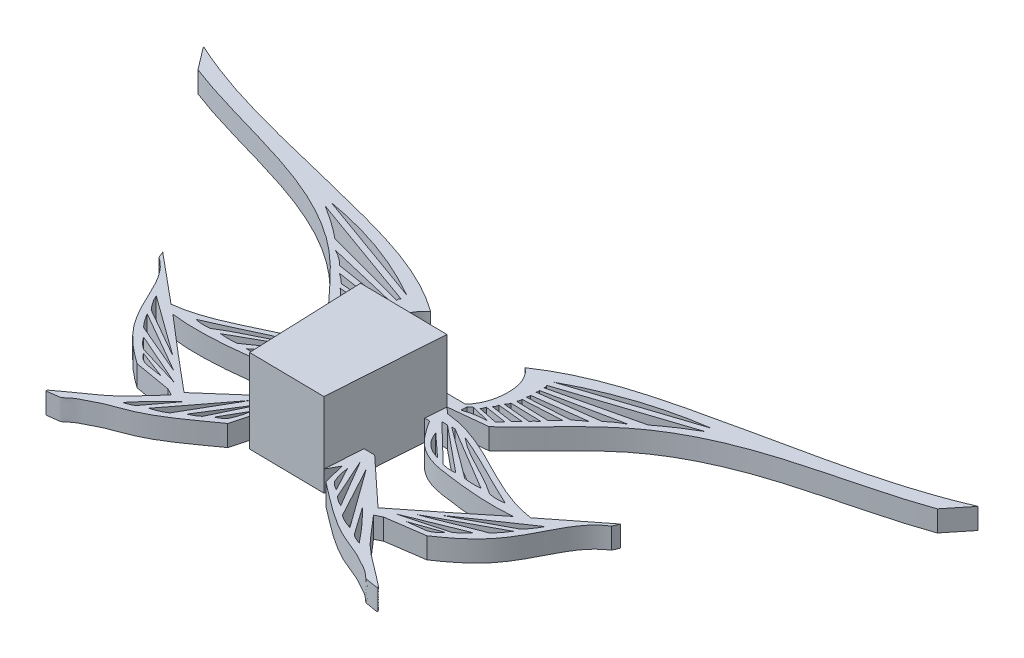
from build123d import *

# Parameters (mm, degrees)
EXTRUDE_2_DEPTH = 5
EXTRUDE_4_DEPTH = 20


with BuildPart() as part:
    # 草图1 → 凸台-拉伸2 (new body)
    with BuildSketch(Plane(origin=(0, 0, 0), x_dir=(1, 0, 0), z_dir=(0, 1, 0))):
        with BuildLine():
            Line((-16.103773819, -29.898359089), (-14.490886088, -30.755289496))
            add(Edge.make_bspline(
                [(-14.490886088, -30.755289496), (-20.884669309, -37.499295163), (-18.447995148, -36.236440216), (-31.189451968, -45.028910304), (-26.993954421, -44.438191538), (-27.357635824, -44.648190251), (-25.248865907, -42.845555476), (-23.405980948, -42.044069648), (-20.595558929, -40.429081018), (-12.612070301, -38.071297427), (-6.528604055, -33.194707099), (-1.848850836, -29.898359089)],
                knots=[0, 0, 0, 0, 0.138213288, 0.158313918, 0.168524285, 0.240316957, 0.287507408, 0.343449858, 0.409538759, 0.538479735, 1, 1, 1, 1], degree=3))
            Line((-1.848850836, -29.898359089), (-0.445645395, -24.742363794))
            Line((-0.445645395, -24.742363794), (1.065498926, -27.584754302))
            Line((1.065498926, -27.584754302), (19.077453467, -27.839259259))
            Line((19.077453467, -27.839259259), (20.668303178, -25.040699244))
            Line((20.668303178, -25.040699244), (21.925271354, -30.234282207))
            add(Edge.make_bspline(
                [(34.538047989, -31.448057553), (40.738734082, -38.370020301), (38.338713296, -37.038823918), (50.82666171, -46.187779954), (46.649529217, -45.478757766), (47.007132144, -45.698948069), (44.950135591, -43.83745193), (43.130631467, -42.984217349), (40.366961188, -41.290468021), (32.453276369, -38.708060865), (26.510021564, -33.661535614), (21.925271354, -30.234282207)],
                knots=[0, 0, 0, 0, 0.138213288, 0.158313918, 0.168524285, 0.240316957, 0.287507408, 0.343449858, 0.409538759, 0.538479735, 1, 1, 1, 1], degree=3))
            Line((34.538047989, -31.448057553), (36.174503464, -30.63703965))
            Line((36.174503464, -30.63703965), (45.171670829, -29.346902954))
            add(Edge.make_bspline(
                [(65.249495162, -5.273250668), (61.766263907, -7.501627612), (58.752904031, -13.633337302), (53.744023944, -23.084612304), (48.232629608, -27.292598923), (45.171670829, -29.346902954)],
                knots=[0, 0, 0, 0, 0.362458305, 0.64917474, 1, 1, 1, 1], degree=3))
            Line((65.249495162, -5.273250668), (65.893558852, -3.785938561))
            Line((65.893558852, -3.785938561), (53.873583233, -13.221108944))
            add(Edge.make_bspline(
                [(22.461513178, -1.624515792), (33.855828878, -2.720380763), (42.541642387, -11.597724795), (53.873583233, -13.221108944)],
                knots=[0, 0, 0, 0, 1, 1, 1, 1], degree=3))
            Line((22.461513178, -1.624515792), (20.921904443, -0.295621909))
            Line((20.921904443, -0.295621909), (30.060393929, 0.666159162))
            add(Edge.make_bspline(
                [(100.611993759, 37.211299403), (88.298262435, 32.83638113), (69.501657366, 30.01745681), (45.090813635, 17.335397796), (36.097400095, 6.236393186), (30.060393929, 0.666159162)],
                knots=[0, 0, 0, 0, 0.482735813, 0.695059024, 1, 1, 1, 1], degree=3))
            Line((100.611993759, 37.211299403), (104.954981583, 42.59415762))
            add(Edge.make_bspline(
                [(22.144921218, 17.160212546), (31.525905639, 23.57487669), (47.510430234, 27.686769801), (75.810112282, 33.739350726), (93.315699901, 37.547379753), (104.954981583, 42.59415762)],
                knots=[0, 0, 0, 0, 0.384359586, 0.564437476, 1, 1, 1, 1], degree=3))
            add(Edge.make_bspline(
                [(22.144921218, 17.160212546), (24.509893208, 15.323249999), (25.990560817, 9.903430905), (24.36483621, 4.419213059), (22.577706713, 2.486317386)],
                knots=[0, 0, 0, 0, 0.513587115, 1, 1, 1, 1], degree=3))
            Line((22.577706713, 2.486317386), (-1.57654055, 2.827611588))
            add(Edge.make_bspline(
                [(-0.729332783, 17.483420725), (-3.145262015, 15.71401126), (-4.778469642, 10.338190539), (-3.308344707, 4.81022902), (-1.57654055, 2.827611588)],
                knots=[0, 0, 0, 0, 0.513587115, 1, 1, 1, 1], degree=3))
            add(Edge.make_bspline(
                [(-0.729332783, 17.483420725), (-9.925332708, 24.160573572), (-25.787298838, 28.722450593), (-53.904673908, 35.572192129), (-71.295681173, 39.873302368), (-82.787724947, 45.246920776)],
                knots=[0, 0, 0, 0, 0.384359586, 0.564437476, 1, 1, 1, 1], degree=3))
            Line((-82.787724947, 45.246920776), (-78.598557779, 39.743505086))
            add(Edge.make_bspline(
                [(-78.598557779, 39.743505086), (-66.413350951, 35.022422204), (-47.703895554, 31.673545498), (-23.661115032, 18.306847429), (-14.984882238, 6.958174602), (-9.107667118, 1.219595251)],
                knots=[0, 0, 0, 0, 0.482735813, 0.695059024, 1, 1, 1, 1], degree=3))
            Line((-9.107667118, 1.219595251), (0, 0))
            Line((0, 0), (-1.57654055, -1.284863379))
            add(Edge.make_bspline(
                [(-1.57654055, -1.284863379), (-12.997269873, -2.058356781), (-21.930435578, -10.686748512), (-33.303719432, -11.989312829)],
                knots=[0, 0, 0, 0, 1, 1, 1, 1], degree=3))
            Line((-33.303719432, -11.989312829), (-45.052315875, -2.218297749))
            Line((-45.052315875, -2.218297749), (-44.450531705, -3.723213413))
            add(Edge.make_bspline(
                [(-44.450531705, -3.723213413), (-41.031651414, -6.049115675), (-38.192739367, -12.263516681), (-33.452894494, -21.852539022), (-28.062592541, -26.214564213), (-25.060897902, -28.354532203)],
                knots=[0, 0, 0, 0, 0.362458305, 0.64917474, 1, 1, 1, 1], degree=3))
            Line((-25.060897902, -28.354532203), (-16.103773819, -29.898359089))
        make_face()
        with BuildLine():
            Line((-35.182838385, 28.178383105), (-7.096711501, 18.095243558))
            add(Edge.make_bspline(
                [(-35.182838385, 28.178383105), (-20.248090795, 25.642813669), (-7.096711501, 18.095243558)],
                knots=[0, 0, 0, 1, 1, 1], degree=2))
        make_face(mode=Mode.SUBTRACT)
        with BuildLine():
            Line((-27.226324633, 21.101852441), (-7.096711501, 15.748621991))
            add(Edge.make_bspline(
                [(-6.962377893, 16.59490624), (-7.386571889, 16.214051513), (-7.096711501, 15.748621991)],
                knots=[0, 0, 0, 1, 1, 1], degree=2))
            Line((-6.962377893, 16.59490624), (-35.182838385, 26.748410587))
            add(Edge.make_bspline(
                [(-35.182838385, 26.748410587), (-31.011643798, 24.200471227), (-27.226324633, 21.101852441)],
                knots=[0, 0, 0, 1, 1, 1], degree=2))
        make_face(mode=Mode.SUBTRACT)
        with BuildLine():
            Line((-21.139774943, 16.152868078), (-7.096711501, 13.89645491))
            add(Edge.make_bspline(
                [(-7.212800722, 14.662905206), (-7.429805602, 14.248762569), (-7.096711501, 13.89645491)],
                knots=[0, 0, 0, 1, 1, 1], degree=2))
            Line((-7.212800722, 14.662905206), (-24.774009417, 18.797669248))
            add(Edge.make_bspline(
                [(-24.774009417, 18.797669248), (-22.73761671, 17.753086901), (-21.139774943, 16.152868078)],
                knots=[0, 0, 0, 1, 1, 1], degree=2))
        make_face(mode=Mode.SUBTRACT)
        with BuildLine():
            Line((-17.203335074, 12.610095473), (-7.096711501, 11.704444121))
            add(Edge.make_bspline(
                [(-7.212800722, 12.610095473), (-7.346401022, 12.118621353), (-7.096711501, 11.704444121)],
                knots=[0, 0, 0, 1, 1, 1], degree=2))
            Line((-7.212800722, 12.610095473), (-19.618405347, 14.542151692))
            add(Edge.make_bspline(
                [(-19.618405347, 14.542151692), (-18.328722121, 13.678456736), (-17.203335074, 12.610095473)],
                knots=[0, 0, 0, 1, 1, 1], degree=2))
        make_face(mode=Mode.SUBTRACT)
        with BuildLine():
            Line((-14.568441476, 9.684985554), (-6.878909657, 9.684985554))
            add(Edge.make_bspline(
                [(-7.096711501, 10.758541597), (-7.210272787, 10.172545053), (-6.878909657, 9.684985554)],
                knots=[0, 0, 0, 1, 1, 1], degree=2))
            Line((-7.096711501, 10.758541597), (-16.415490281, 11.532034359))
            add(Edge.make_bspline(
                [(-16.415490281, 11.532034359), (-15.39023398, 10.70783761), (-14.568441476, 9.684985554)],
                knots=[0, 0, 0, 1, 1, 1], degree=2))
        make_face(mode=Mode.SUBTRACT)
        with BuildLine():
            Line((-12.597455703, 7.173307626), (-6.033635061, 7.598824657))
            add(Edge.make_bspline(
                [(-6.577025872, 8.645355108), (-6.588564664, 7.987642833), (-6.033635061, 7.598824657)],
                knots=[0, 0, 0, 1, 1, 1], degree=2))
            Line((-6.577025872, 8.645355108), (-14.069503186, 8.645355108))
            add(Edge.make_bspline(
                [(-14.069503186, 8.645355108), (-13.220747499, 8.018539858), (-12.597455703, 7.173307626)],
                knots=[0, 0, 0, 1, 1, 1], degree=2))
        make_face(mode=Mode.SUBTRACT)
        with BuildLine():
            Line((-10.561891823, 5.002624113), (-5.127983709, 5.656705645))
            add(Edge.make_bspline(
                [(-5.651248934, 6.753550061), (-5.724038036, 6.080064551), (-5.127983709, 5.656705645)],
                knots=[0, 0, 0, 1, 1, 1], degree=2))
            Line((-5.651248934, 6.753550061), (-11.870054888, 6.310787178))
            add(Edge.make_bspline(
                [(-11.870054888, 6.310787178), (-11.164820436, 5.706807997), (-10.561891823, 5.002624113)],
                knots=[0, 0, 0, 1, 1, 1], degree=2))
        make_face(mode=Mode.SUBTRACT)
        with BuildLine():
            Line((-36.84765898, -11.989312829), (-22.414436084, -22.449877147))
            Line((-22.414436084, -22.449877147), (-34.46516185, -15.573723069))
            add(Edge.make_bspline(
                [(-36.84765898, -11.989312829), (-35.929119346, -13.978075815), (-34.46516185, -15.573723069)],
                knots=[0, 0, 0, 1, 1, 1], degree=2))
        make_face(mode=Mode.SUBTRACT)
        with BuildLine():
            Line((-8.763785997, 2.936617502), (-4.222332356, 3.73471222))
            add(Edge.make_bspline(
                [(-4.624844068, 4.801368257), (-4.476594662, 4.247232566), (-4.222332356, 3.73471222)],
                knots=[0, 0, 0, 1, 1, 1], degree=2))
            Line((-4.624844068, 4.801368257), (-9.944266841, 4.117098346))
            add(Edge.make_bspline(
                [(-9.944266841, 4.117098346), (-9.328370075, 3.552076692), (-8.763785997, 2.936617502)],
                knots=[0, 0, 0, 1, 1, 1], degree=2))
        make_face(mode=Mode.SUBTRACT)
        with BuildLine():
            Line((-7.72998178, 2.222902012), (-3.135550733, 3.171195822))
            Line((-3.135550733, 3.171195822), (-2.31624848, 2.539010698))
            Line((-2.31624848, 2.539010698), (-2.31624848, 1.09027332))
            add(Edge.make_bspline(
                [(-7.72998178, 2.222902012), (-4.908530756, 2.12376403), (-2.31624848, 1.09027332)],
                knots=[0, 0, 0, 1, 1, 1], degree=2))
        make_face(mode=Mode.SUBTRACT)
        with BuildLine():
            Line((-21.277849249, -12.169413542), (-5.619725363, -3.409622108))
            Line((-5.619725363, -3.409622108), (-4.777911564, -3.409622108))
            Line((-4.777911564, -3.409622108), (-17.294022325, -12.185739206))
            add(Edge.make_bspline(
                [(-21.277849249, -12.169413542), (-19.284856232, -12.422115128), (-17.294022325, -12.185739206)],
                knots=[0, 0, 0, 1, 1, 1], degree=2))
        make_face(mode=Mode.SUBTRACT)
        with BuildLine():
            Line((-15.060534866, -12.169413542), (-3.907902416, -3.560230994))
            Line((-3.907902416, -3.560230994), (-2.533839168, -3.560230994))
            Line((-2.533839168, -3.560230994), (-11.775299344, -11.989312829))
            add(Edge.make_bspline(
                [(-15.060534866, -12.169413542), (-13.387909137, -12.414610369), (-11.775299344, -11.989312829)],
                knots=[0, 0, 0, 1, 1, 1], degree=2))
        make_face(mode=Mode.SUBTRACT)
        with BuildLine():
            Line((-9.696270638, -11.331649493), (-4.222332356, -6.583488886))
            add(Edge.make_bspline(
                [(-4.222332356, -6.583488886), (-5.675921625, -10.412613855), (-9.696270638, -11.331649493)],
                knots=[0, 0, 0, 1, 1, 1], degree=2))
        make_face(mode=Mode.SUBTRACT)
        with BuildLine():
            Line((-34.190967534, -16.812533396), (-19.152491915, -25.453678758))
            Line((-19.152491915, -25.453678758), (-31.801181639, -20.077041431))
            add(Edge.make_bspline(
                [(-34.190967534, -16.812533396), (-33.148322725, -18.557993128), (-31.801181639, -20.077041431)],
                knots=[0, 0, 0, 1, 1, 1], degree=2))
        make_face(mode=Mode.SUBTRACT)
        with BuildLine():
            Line((-29.805020775, -22.059096425), (-16.825789187, -27.761152537))
            Line((-16.825789187, -27.761152537), (-27.226324633, -24.629598887))
            add(Edge.make_bspline(
                [(-29.805020775, -22.059096425), (-28.753568462, -23.570254947), (-27.226324633, -24.629598887)],
                knots=[0, 0, 0, 1, 1, 1], degree=2))
        make_face(mode=Mode.SUBTRACT)
        with BuildLine():
            Line((-26.403696421, -25.453678758), (-19.618405347, -28.040940898))
            Line((-19.618405347, -28.040940898), (-23.753393557, -27.400982827))
            add(Edge.make_bspline(
                [(-26.403696421, -25.453678758), (-25.454954951, -26.959998203), (-23.753393557, -27.400982827)],
                knots=[0, 0, 0, 1, 1, 1], degree=2))
        make_face(mode=Mode.SUBTRACT)
        with BuildLine():
            Line((-3.907902416, -22.449877147), (-14.415839762, -36.170569033))
            add(Edge.make_bspline(
                [(-14.415839762, -36.170569033), (-12.54622165, -35.702818924), (-10.955616626, -34.661907538)],
                knots=[0, 0, 0, 1, 1, 1], degree=2))
            Line((-10.955616626, -34.661907538), (-3.907902416, -22.449877147))
        make_face(mode=Mode.SUBTRACT)
        with BuildLine():
            Line((-16.488222725, -37.137514335), (-11.459063089, -30.418720963))
            add(Edge.make_bspline(
                [(-11.459063089, -30.418720963), (-15.368555435, -34.053202491), (-18.795038149, -38.140885271)],
                knots=[0, 0, 0, 1, 1, 1], degree=2))
            add(Edge.make_bspline(
                [(-18.795038149, -38.140885271), (-17.56459076, -37.811943726), (-16.488222725, -37.137514335)],
                knots=[0, 0, 0, 1, 1, 1], degree=2))
        make_face(mode=Mode.SUBTRACT)
        with BuildLine():
            Line((-8.667555799, -32.861466231), (-1.57654055, -21.581573034))
            Line((-1.57654055, -21.581573034), (-6.351363076, -31.473626057))
            add(Edge.make_bspline(
                [(-8.667555799, -32.861466231), (-7.397877731, -32.343744937), (-6.351363076, -31.473626057)],
                knots=[0, 0, 0, 1, 1, 1], degree=2))
        make_face(mode=Mode.SUBTRACT)
        with BuildLine():
            Line((-4.777911564, -30.21116539), (-1.57654055, -24.629598887))
            add(Edge.make_bspline(
                [(-1.57654055, -24.629598887), (-1.819327272, -26.800151593), (-2.780160589, -28.727289228)],
                knots=[0, 0, 0, 1, 1, 1], degree=2))
            add(Edge.make_bspline(
                [(-4.777911564, -30.21116539), (-3.582687149, -29.722654584), (-2.780160589, -28.727289228)],
                knots=[0, 0, 0, 1, 1, 1], degree=2))
        make_face(mode=Mode.SUBTRACT)
        with BuildLine():
            Line((30.893812613, -35.25323077), (24.193949723, -22.846950138))
            Line((24.193949723, -22.846950138), (34.310028753, -36.85905484))
            add(Edge.make_bspline(
                [(34.310028753, -36.85905484), (32.454372807, -36.338667427), (30.893812613, -35.25323077)],
                knots=[0, 0, 0, 1, 1, 1], degree=2))
        make_face(mode=Mode.SUBTRACT)
        with BuildLine():
            Line((26.381478628, -31.936133912), (21.888051582, -21.913122561))
            Line((21.888051582, -21.913122561), (28.657534752, -33.388861553))
            add(Edge.make_bspline(
                [(28.657534752, -33.388861553), (27.402991223, -32.835473562), (26.381478628, -31.936133912)],
                knots=[0, 0, 0, 1, 1, 1], degree=2))
        make_face(mode=Mode.SUBTRACT)
        with BuildLine():
            Line((24.844324734, -30.629721074), (21.801932905, -24.959931575))
            add(Edge.make_bspline(
                [(21.801932905, -24.959931575), (21.983296081, -27.136477427), (22.889296622, -29.089993014)],
                knots=[0, 0, 0, 1, 1, 1], degree=2))
            add(Edge.make_bspline(
                [(24.844324734, -30.629721074), (23.663379823, -30.107635518), (22.889296622, -29.089993014)],
                knots=[0, 0, 0, 1, 1, 1], degree=2))
        make_face(mode=Mode.SUBTRACT)
        with BuildLine():
            Line((36.354264381, -37.884167057), (31.51694474, -31.025962503))
            add(Edge.make_bspline(
                [(31.51694474, -31.025962503), (35.322187984, -34.769451548), (38.631809713, -38.952314003)],
                knots=[0, 0, 0, 1, 1, 1], degree=2))
            add(Edge.make_bspline(
                [(38.631809713, -38.952314003), (37.411147433, -38.588738817), (36.354264381, -37.884167057)],
                knots=[0, 0, 0, 1, 1, 1], degree=2))
        make_face(mode=Mode.SUBTRACT)
        with BuildLine():
            Line((39.740211218, -28.879665096), (43.891629975, -28.356792134))
            add(Edge.make_bspline(
                [(46.595893752, -26.485146914), (45.604971612, -27.964059339), (43.891629975, -28.356792134)],
                knots=[0, 0, 0, 1, 1, 1], degree=2))
            Line((46.595893752, -26.485146914), (39.740211218, -28.879665096))
        make_face(mode=Mode.SUBTRACT)
        with BuildLine():
            Line((36.956615049, -28.521086082), (47.44147704, -25.684638504))
            add(Edge.make_bspline(
                [(50.091770479, -23.188020515), (48.998041778, -24.668868101), (47.44147704, -25.684638504)],
                knots=[0, 0, 0, 1, 1, 1], degree=2))
            Line((50.091770479, -23.188020515), (36.956615049, -28.521086082))
        make_face(mode=Mode.SUBTRACT)
        with BuildLine():
            Line((39.347584084, -26.280271967), (52.143135254, -21.263156169))
            add(Edge.make_bspline(
                [(54.624202241, -18.067472213), (53.5326576, -19.782776318), (52.143135254, -21.263156169)],
                knots=[0, 0, 0, 1, 1, 1], degree=2))
            Line((54.624202241, -18.067472213), (39.347584084, -26.280271967))
        make_face(mode=Mode.SUBTRACT)
        with BuildLine():
            Line((30.29414061, -11.896705209), (24.956541789, -6.995779961))
            add(Edge.make_bspline(
                [(24.956541789, -6.995779961), (26.301362966, -10.864445854), (30.29414061, -11.896705209)],
                knots=[0, 0, 0, 1, 1, 1], degree=2))
        make_face(mode=Mode.SUBTRACT)
        with BuildLine():
            Line((23.354141569, -3.926022469), (32.353757756, -12.612846701))
            add(Edge.make_bspline(
                [(35.63259319, -12.885696293), (33.953707438, -13.083537), (32.353757756, -12.612846701)],
                knots=[0, 0, 0, 1, 1, 1], degree=2))
            Line((35.63259319, -12.885696293), (24.727656261, -3.964845141))
            Line((24.727656261, -3.964845141), (23.354141569, -3.926022469))
        make_face(mode=Mode.SUBTRACT)
        with BuildLine():
            Line((25.601573374, -3.83887755), (37.864727729, -12.965120214))
            add(Edge.make_bspline(
                [(41.847425486, -13.061359792), (39.848088305, -13.257650631), (37.864727729, -12.965120214)],
                knots=[0, 0, 0, 1, 1, 1], degree=2))
            Line((41.847425486, -13.061359792), (26.443051103, -3.862662089))
            Line((26.443051103, -3.862662089), (25.601573374, -3.83887755))
        make_face(mode=Mode.SUBTRACT)
        with BuildLine():
            Line((42.693095183, -23.369832246), (54.93328834, -16.836903511))
            add(Edge.make_bspline(
                [(57.416107963, -13.321239126), (56.441744682, -15.28325581), (54.93328834, -16.836903511)],
                knots=[0, 0, 0, 1, 1, 1], degree=2))
            Line((57.416107963, -13.321239126), (42.693095183, -23.369832246))
        make_face(mode=Mode.SUBTRACT)
        with BuildLine():
            Line((23.30896523, 2.176932064), (23.268032721, 0.728773053))
            add(Edge.make_bspline(
                [(28.711605941, 1.707990391), (25.888480265, 1.688609037), (23.268032721, 0.728773053)],
                knots=[0, 0, 0, 1, 1, 1], degree=2))
            Line((28.711605941, 1.707990391), (24.145802108, 2.785716306))
            Line((24.145802108, 2.785716306), (23.30896523, 2.176932064))
        make_face(mode=Mode.SUBTRACT)
        with BuildLine():
            Line((30.978525482, 3.53886829), (25.680559645, 4.373159567))
            add(Edge.make_bspline(
                [(25.680559645, 4.373159567), (25.556150915, 3.804573877), (25.24807141, 3.318301895)],
                knots=[0, 0, 0, 1, 1, 1], degree=2))
            Line((25.24807141, 3.318301895), (29.765162701, 2.39221193))
            add(Edge.make_bspline(
                [(30.978525482, 3.53886829), (30.346910519, 2.991473702), (29.765162701, 2.39221193)],
                knots=[0, 0, 0, 1, 1, 1], degree=2))
        make_face(mode=Mode.SUBTRACT)
        with BuildLine():
            Line((32.965525019, 5.677270293), (26.761711535, 6.295562058))
            add(Edge.make_bspline(
                [(26.761711535, 6.295562058), (26.815442972, 5.62028884), (26.207665054, 5.213939819)],
                knots=[0, 0, 0, 1, 1, 1], degree=2))
            Line((26.207665054, 5.213939819), (31.620923468, 4.406590209))
            add(Edge.make_bspline(
                [(32.965525019, 5.677270293), (32.243507334, 5.093457872), (31.620923468, 4.406590209)],
                knots=[0, 0, 0, 1, 1, 1], degree=2))
        make_face(mode=Mode.SUBTRACT)
        with BuildLine():
            Line((37.656666473, 10.768006675), (28.319753749, 10.258114732))
            add(Edge.make_bspline(
                [(28.319753749, 10.258114732), (28.416713, 9.669143579), (28.07170669, 9.191141031)],
                knots=[0, 0, 0, 1, 1, 1], degree=2))
            Line((28.07170669, 9.191141031), (35.758168681, 8.97388162))
            add(Edge.make_bspline(
                [(37.656666473, 10.768006675), (36.608532688, 9.973106472), (35.758168681, 8.97388162)],
                knots=[0, 0, 0, 1, 1, 1], degree=2))
        make_face(mode=Mode.SUBTRACT)
        with BuildLine():
            Line((35.230055944, 7.948763179), (27.74056979, 8.160455028))
            add(Edge.make_bspline(
                [(27.74056979, 8.160455028), (27.733521025, 7.50267931), (27.167827325, 7.129695294)],
                knots=[0, 0, 0, 1, 1, 1], degree=2))
            Line((27.167827325, 7.129695294), (33.717005024, 6.518894481))
            add(Edge.make_bspline(
                [(35.230055944, 7.948763179), (34.363929112, 7.346178842), (33.717005024, 6.518894481)],
                knots=[0, 0, 0, 1, 1, 1], degree=2))
        make_face(mode=Mode.SUBTRACT)
        with BuildLine():
            Line((40.943350478, 13.6864274), (28.488110279, 12.105649452))
            add(Edge.make_bspline(
                [(28.488110279, 12.105649452), (28.607771173, 11.610596806), (28.346479203, 11.203639631)],
                knots=[0, 0, 0, 1, 1, 1], degree=2))
            Line((28.346479203, 11.203639631), (38.474656193, 11.823377701))
            add(Edge.make_bspline(
                [(40.943350478, 13.6864274), (39.629779353, 12.859515856), (38.474656193, 11.823377701)],
                knots=[0, 0, 0, 1, 1, 1], degree=2))
        make_face(mode=Mode.SUBTRACT)
        with BuildLine():
            Line((46.217131368, 17.794580041), (28.546110199, 14.157639658))
            add(Edge.make_bspline(
                [(28.546110199, 14.157639658), (28.751327293, 13.737531118), (28.408412098, 13.394775322)],
                knots=[0, 0, 0, 1, 1, 1], degree=2))
            Line((28.408412098, 13.394775322), (42.509621761, 15.2535161))
            add(Edge.make_bspline(
                [(46.217131368, 17.794580041), (44.152038088, 16.807950789), (42.509621761, 15.2535161)],
                knots=[0, 0, 0, 1, 1, 1], degree=2))
        make_face(mode=Mode.SUBTRACT)
        with BuildLine():
            Line((48.733569773, 20.028555838), (28.460743078, 15.246202977))
            add(Edge.make_bspline(
                [(28.350373945, 16.095944822), (28.763637955, 15.703256997), (28.460743078, 15.246202977)],
                knots=[0, 0, 0, 1, 1, 1], degree=2))
            Line((28.350373945, 16.095944822), (56.84644451, 25.448057059))
            add(Edge.make_bspline(
                [(56.84644451, 25.448057059), (52.604925881, 23.018987485), (48.733569773, 20.028555838)],
                knots=[0, 0, 0, 1, 1, 1], degree=2))
        make_face(mode=Mode.SUBTRACT)
        with BuildLine():
            Line((56.886846838, 26.8774587), (28.527044334, 17.591887722))
            add(Edge.make_bspline(
                [(56.886846838, 26.8774587), (41.886421749, 24.764866671), (28.527044334, 17.591887722)],
                knots=[0, 0, 0, 1, 1, 1], degree=2))
        make_face(mode=Mode.SUBTRACT)
        with BuildLine():
            Line((-0.985903289, -4.958111164), (21.767328065, -5.27960932))
            add(Edge.make_bspline(
                [(51.514970035, -15.027015613), (46.003668635, -15.514090272), (37.648914264, -14.774177187), (29.707301923, -13.418699286), (24.917056729, -10.135076162), (23.125564629, -7.402443737), (21.767328065, -5.27960932)],
                knots=[0, 0, 0, 0, 0.521809523, 0.750761498, 0.78753114, 1, 1, 1, 1], degree=3))
            add(Edge.make_bspline(
                [(51.514970035, -15.027015613), (42.607353534, -22.294292787), (33.563857978, -29.391711661)],
                knots=[0, 0, 0, 1, 1, 1], degree=2))
            Line((33.563857978, -29.391711661), (22.246165704, -18.881300023))
            Line((22.246165704, -18.881300023), (-1.848850836, -18.540842738))
            Line((-1.848850836, -18.540842738), (-13.458985163, -28.727289228))
            add(Edge.make_bspline(
                [(-30.997071786, -13.861138608), (-22.298340461, -21.377189604), (-13.458985163, -28.727289228)],
                knots=[0, 0, 0, 1, 1, 1], degree=2))
            add(Edge.make_bspline(
                [(-30.997071786, -13.861138608), (-25.501732384, -14.50373468), (-17.129407968, -14.00017154), (-9.152668528, -12.869616449), (-4.27156048, -9.72264742), (-2.403576007, -7.041722594), (-0.985903289, -4.958111164)],
                knots=[0, 0, 0, 0, 0.521809523, 0.750761498, 0.78753114, 1, 1, 1, 1], degree=3))
        make_face(mode=Mode.SUBTRACT)
        with BuildLine():
            add(Edge.make_bspline(
                [(-27.226324633, -12.169413542), (-20.950326675, -9.519893491), (-14.926042611, -6.272985991), (-8.538140323, -3.884202973)],
                knots=[0, 0, 0, 0, 1, 1, 1, 1], degree=3))
            add(Edge.make_bspline(
                [(-8.538140323, -3.884202973), (-13.103340217, -7.47297977), (-18.759909816, -9.130831844), (-23.580875914, -12.298626313)],
                knots=[0, 0, 0, 0, 1, 1, 1, 1], degree=3))
            add(Edge.make_bspline(
                [(-27.226324633, -12.169413542), (-25.405158362, -12.556798943), (-23.580875914, -12.298626313)],
                knots=[0, 0, 0, 1, 1, 1], degree=2))
        make_face(mode=Mode.SUBTRACT)
        with BuildLine():
            add(Edge.make_bspline(
                [(47.79352611, -13.229427535), (45.962141732, -13.565203199), (44.145881966, -13.255590507)],
                knots=[0, 0, 0, 1, 1, 1], degree=2))
            add(Edge.make_bspline(
                [(29.346892199, -4.419510152), (33.808872556, -8.135839019), (39.416343111, -9.952849505), (44.145881966, -13.255590507)],
                knots=[0, 0, 0, 0, 1, 1, 1, 1], degree=3))
            add(Edge.make_bspline(
                [(47.79352611, -13.229427535), (41.594892992, -10.40364369), (35.664751815, -6.987822791), (29.346892199, -4.419510152)],
                knots=[0, 0, 0, 0, 1, 1, 1, 1], degree=3))
        make_face(mode=Mode.SUBTRACT)
    extrude(amount=EXTRUDE_2_DEPTH)

    # 草图15 → 凸台-拉伸4 (add)
    with BuildSketch(Plane(origin=(0, 0, 0), x_dir=(1, 0, 0), z_dir=(0, 1, 0))):
        Polygon((0, 0), (1.065498926, -27.584754302), (19.077453467, -27.839259259), (20.921904443, -0.295621909), align=None)
    extrude(amount=EXTRUDE_4_DEPTH)


solid = part.part
